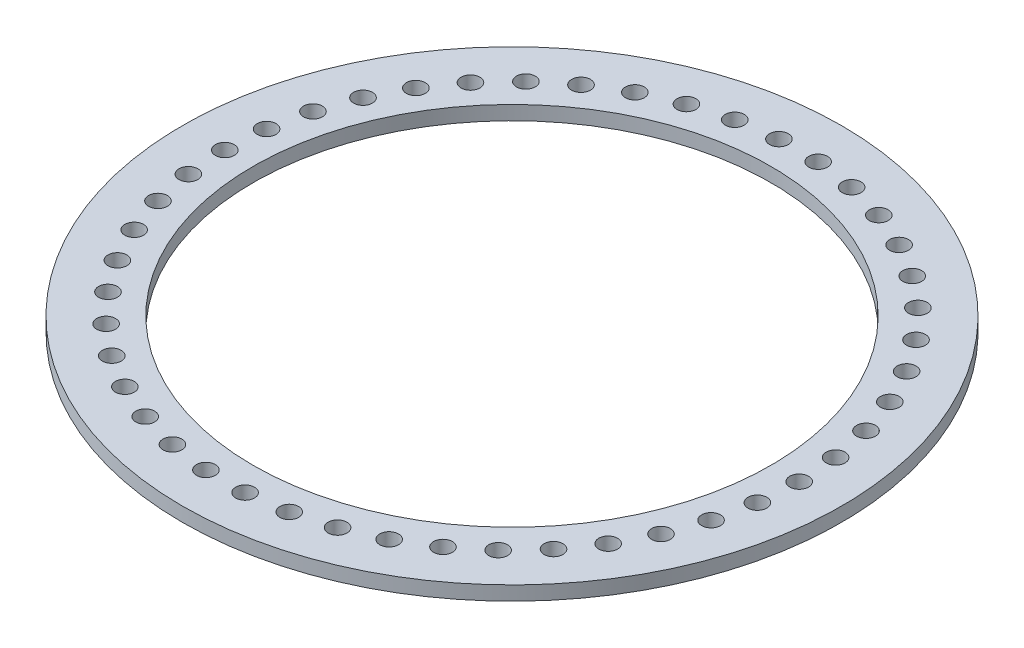
from build123d import *

# Parameters (mm, degrees)
SKETCH1_R           = 35
SKETCH1_R_2         = 27.5
BOSS_EXTRUDE1_DEPTH = 1.5
SKETCH2_R           = 1
CUT_EXTRUDE1_DEPTH  = 1.5
CIRPATTERN1_COUNT   = 46


with BuildPart() as part:
    # Sketch1 → Boss-Extrude1 (new body)
    with BuildSketch(Plane(origin=(0, 0, 0), x_dir=(1, 0, 0), z_dir=(0, 1, 0))):
        with Locations(Location((0, 0, 0), (0, 0, 270))):
            Circle(SKETCH1_R)
        with Locations(Location((0, 0, 0), (0, 0, 270))):
            Circle(SKETCH1_R_2, mode=Mode.SUBTRACT)
    extrude(amount=BOSS_EXTRUDE1_DEPTH)

    # Sketch2 → Cut-Extrude1 (cut)
    with BuildSketch(Plane(origin=(0, 1.5, 0), x_dir=(1, 0, 0), z_dir=(0, 1, 0))):
        with Locations(Location((30.5, 0, 0), (0, 0, 270))):
            Circle(SKETCH2_R)
    cut_extrude1 = extrude(amount=-CUT_EXTRUDE1_DEPTH, mode=Mode.SUBTRACT)

    # CirPattern1: Cut-Extrude1 ×46 about axis
    cirpattern1_axis = Axis((0, 0, 0), (0, 1, 0))
    for i in range(1, CIRPATTERN1_COUNT):
        add(cut_extrude1.rotate(cirpattern1_axis, i * 360 / CIRPATTERN1_COUNT), mode=Mode.SUBTRACT)


solid = part.part
